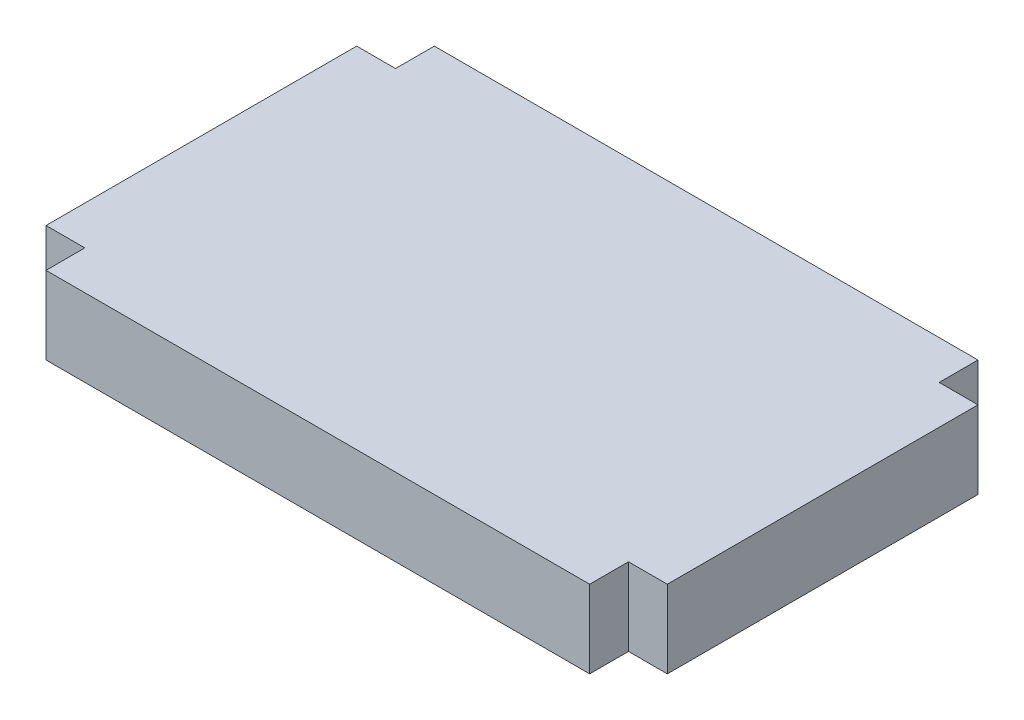
from build123d import *

# Parameters (mm, degrees)
BOSS_EXTRUDE1_DEPTH = 6.35


with BuildPart() as part:
    # Sketch2 → Boss-Extrude1 (new body)
    with BuildSketch(Plane(origin=(0, 0, 0), x_dir=(1, 0, 0), z_dir=(0, 1, 0))):
        Polygon((-22.225, 12.7), (-22.225, 15.875), (22.225, 15.875), (22.225, 12.7), (25.4, 12.7), (25.4, -12.7), (22.225, -12.7), (22.225, -15.875), (-22.225, -15.875), (-22.225, -12.7), (-25.4, -12.7), (-25.4, 12.7), align=None)
    extrude(amount=BOSS_EXTRUDE1_DEPTH)


solid = part.part
